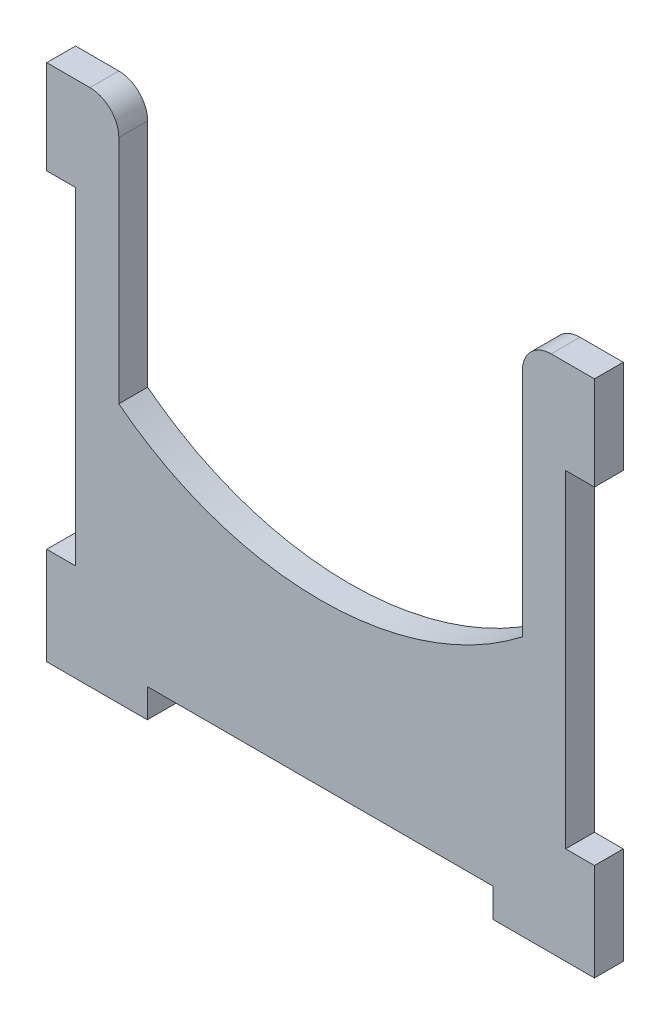
from build123d import *

# Parameters (mm, degrees)
AUFSATZ_LINEAR_AUSTRAGEN1_DEPTH = 5


with BuildPart() as part:
    # Skizze1 → Aufsatz-Linear austragen1 (new body)
    with BuildSketch(Plane.XY):
        with BuildLine():
            Line((-61.378328771, 63.819239112), (-56.378328771, 63.819239112))
            Line((-56.378328771, 63.819239112), (-56.378328771, 6.977133849))
            Line((-56.378328771, 6.977133849), (-61.378328771, 6.977133849))
            Line((-61.378328771, 6.977133849), (-61.378328771, -9.921658625))
            Line((-61.378328771, -9.921658625), (-43.939454059, -9.921658625))
            Line((-43.939454059, -9.921658625), (-43.939454059, -4.921658625))
            Line((-43.939454059, -4.921658625), (16.060545941, -4.921658625))
            Line((16.060545941, -4.921658625), (16.060545941, -9.921658625))
            Line((16.060545941, -9.921658625), (33.621671229, -9.921658625))
            Line((33.621671229, -9.921658625), (33.621671229, 6.977133849))
            Line((33.621671229, 6.977133849), (28.621671229, 6.977133849))
            Line((28.621671229, 6.977133849), (28.621671229, 63.819239112))
            Line((28.621671229, 63.819239112), (33.621671229, 63.819239112))
            Line((33.621671229, 63.819239112), (33.621671229, 80.078341375))
            Line((33.621671229, 80.078341375), (26.121671229, 80.078341375))
            ThreePointArc((26.121671229, 80.078341375), (22.586137323, 78.613875281), (21.121671229, 75.078341375))
            Line((21.121671229, 75.078341375), (21.121671229, 35.078341375))
            ThreePointArc((21.121671229, 35.078341375), (-13.878328771, 23.078341375), (-48.878328771, 35.078341375))
            Line((-48.878328771, 35.078341375), (-48.878328771, 75.078341375))
            ThreePointArc((-48.878328771, 75.078341375), (-50.342794866, 78.613875281), (-53.878328771, 80.078341375))
            Line((-53.878328771, 80.078341375), (-61.378328771, 80.078341375))
            Line((-61.378328771, 80.078341375), (-61.378328771, 63.819239112))
        make_face()
    extrude(amount=AUFSATZ_LINEAR_AUSTRAGEN1_DEPTH)


solid = part.part
